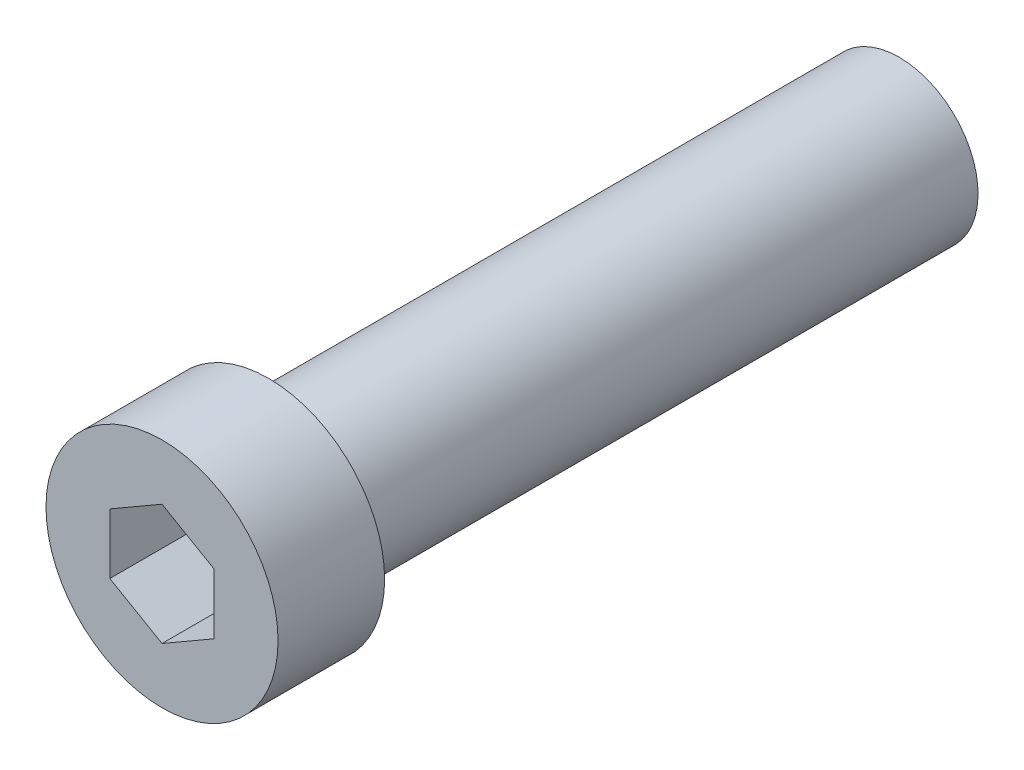
from build123d import *

# Parameters (mm, degrees)
SKETCH_1_W          = 2.208
SKETCH_1_H          = 2.028
SKETCH_2_R          = 1.5
EXTRUDE_1_DEPTH     = 12
CUT_EXTRUDE_1_DEPTH = 1.872


with BuildPart() as part:
    # 草图1 → 旋转1 (revolve)
    with BuildSketch(Plane.XZ, mode=Mode.PRIVATE) as revolve_1_sk:
        with Locations((1.104, 1.014)):
            Rectangle(SKETCH_1_W, SKETCH_1_H)
    revolve(revolve_1_sk.sketch.rotate(Axis((0, 0, 2.028), (0, 0, -1)), 270), axis=Axis((0, 0, 2.028), (0, 0, -1)))

    # 草图2 → 凸台-拉伸1 (add)
    with BuildSketch(Plane(origin=(0, 0, 0), x_dir=(-1, 0, 0), z_dir=(0, 0, -1))):
        with Locations(Location((0, 0, 0), (0, 0, 90))):
            Circle(SKETCH_2_R)
    extrude(amount=EXTRUDE_1_DEPTH)

    # 草图3 → 切除-拉伸1 (cut)
    with BuildSketch(Plane.XY.offset(2.028)):
        Polygon((0.9936, -0.573655227), (0.9936, 0.573655227), (0, 1.147310455), (-0.9936, 0.573655227), (-0.9936, -0.573655227), (0, -1.147310455), align=None)
    extrude(amount=-CUT_EXTRUDE_1_DEPTH, mode=Mode.SUBTRACT)


solid = part.part
